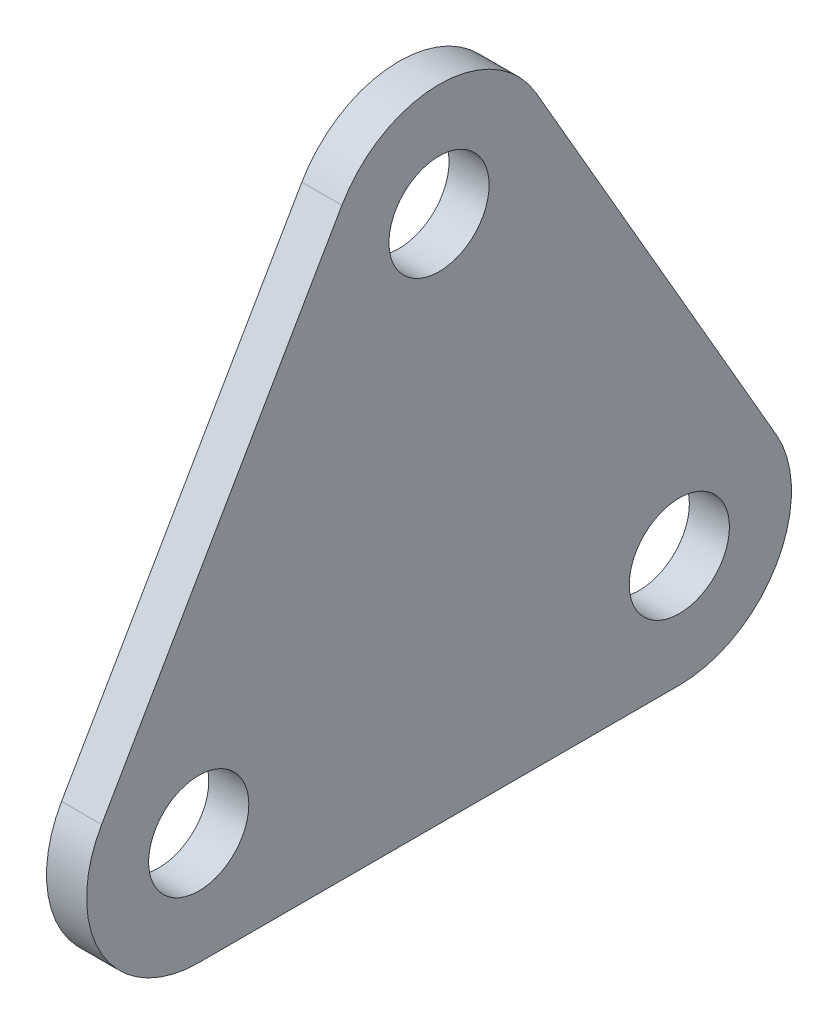
from build123d import *

# Parameters (mm, degrees)
SKETCH1_R           = 5
BOSS_EXTRUDE1_DEPTH = 4


with BuildPart() as part:
    # Sketch1 → Boss-Extrude1 (new body)
    with BuildSketch(Plane(origin=(0, 0, 0), x_dir=(0, 0, -1), z_dir=(1, 0, 0))):
        with BuildLine():
            Line((-31.850752253, 36.420784179), (-7.861259629, -5.130235893))
            ThreePointArc((-7.861259629, -5.130235893), (-7.861259629, -16.324481088), (-17.555760345, -21.921603686))
            Line((-17.555760345, -21.921603686), (-65.534745592, -21.921603686))
            ThreePointArc((-65.534745592, -21.921603686), (-75.229246307, -16.324481088), (-75.229246307, -5.130235893))
            Line((-75.229246307, -5.130235893), (-51.239753683, 36.420784179))
            ThreePointArc((-51.239753683, 36.420784179), (-41.545252968, 42.017906776), (-31.850752253, 36.420784179))
        make_face()
        with Locations((-41.545252968, 30.823661581)):
            Circle(SKETCH1_R, mode=Mode.SUBTRACT)
        with Locations((-17.555760345, -10.727358491)):
            Circle(SKETCH1_R, mode=Mode.SUBTRACT)
        with Locations((-65.534745592, -10.727358491)):
            Circle(SKETCH1_R, mode=Mode.SUBTRACT)
    extrude(amount=BOSS_EXTRUDE1_DEPTH)


solid = part.part
